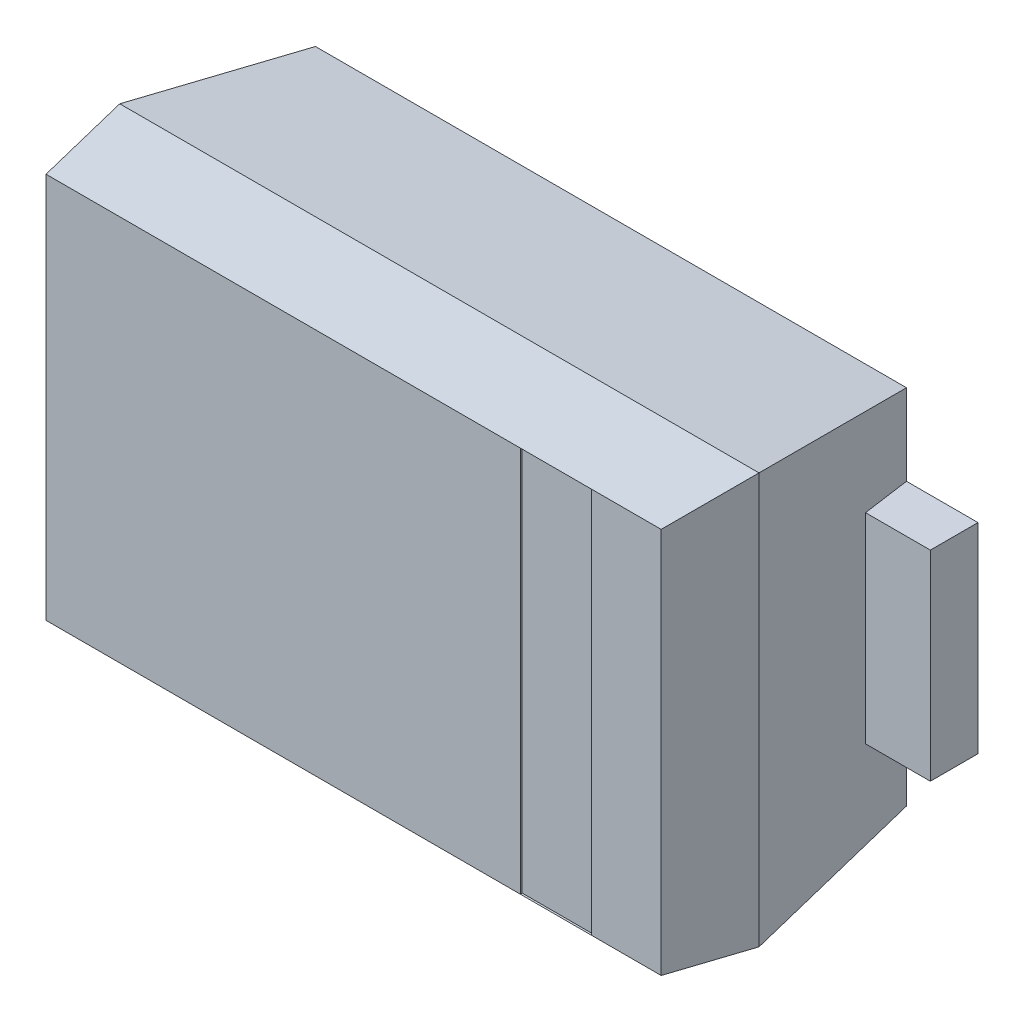
from build123d import *

# Parameters (mm, degrees)
CROQUIS1_W              = 3.85
CROQUIS1_H              = 1.05
SALIENTE_EXTRUIR1_DEPTH = 0.25
CROQUIS2_W              = 3.1
CROQUIS2_H              = 1.9
SALIENTE_EXTRUIR2_DEPTH = 0.9
SALIENTE_EXTRUIR2_DRAFT = 8
CROQUIS3_W              = 3.352973502
CROQUIS3_H              = 2.152973502
SALIENTE_EXTRUIR3_DEPTH = 0.45
SALIENTE_EXTRUIR3_TAPER = 8
CROQUIS4_W              = 0.372299527
CROQUIS4_H              = 2.026486752
CORTAR_EXTRUIR1_DEPTH   = 0.01


with BuildPart() as part:
    # Croquis1 → Saliente-Extruir1 (new body)
    with BuildSketch(Plane.XY):
        Rectangle(CROQUIS1_W, CROQUIS1_H)
    extrude(amount=SALIENTE_EXTRUIR1_DEPTH)


with BuildPart() as saliente_extruir2_tool:
    # Croquis2 → Saliente-Extruir2 (with draft: the straight prism first)
    with BuildSketch(Plane(origin=(0, 0, 0), x_dir=(-1, 0, 0), z_dir=(0, 0, -1))):
        Rectangle(CROQUIS2_W, CROQUIS2_H)
    extrude(amount=-SALIENTE_EXTRUIR2_DEPTH)
    # Saliente-Extruir2: the draft: its side faces are tilted about the plane it starts from
    saliente_extruir2_sides = [saliente_extruir2_tool.faces().sort_by_distance(p)[0] for p in [
        (0, 0.95, 0.45),
        (1.55, 0, 0.45),
        (0, -0.95, 0.45),
        (-1.55, 0, 0.45),
    ]]
    draft(saliente_extruir2_sides, Plane(origin=(0, 0, 0), x_dir=(-1, 0, 0), z_dir=(0, 0, -1)), SALIENTE_EXTRUIR2_DRAFT)


with BuildPart() as part_1:
    add(part.part)

    # Saliente-Extruir2: add saliente_extruir2_tool
    add(saliente_extruir2_tool.part)

    # Croquis3 → Saliente-Extruir3 (add)
    with BuildSketch(Plane.XY.offset(0.9)):
        Rectangle(CROQUIS3_W, CROQUIS3_H)
    extrude(amount=SALIENTE_EXTRUIR3_DEPTH, taper=SALIENTE_EXTRUIR3_TAPER)

    # Croquis4 → Cortar-Extruir1 (cut)
    with BuildSketch(Plane.XY.offset(1.35)):
        with Locations((1.060489564, 0)):
            Rectangle(CROQUIS4_W, CROQUIS4_H)
    extrude(amount=-CORTAR_EXTRUIR1_DEPTH, mode=Mode.SUBTRACT)


solid = part_1.part
